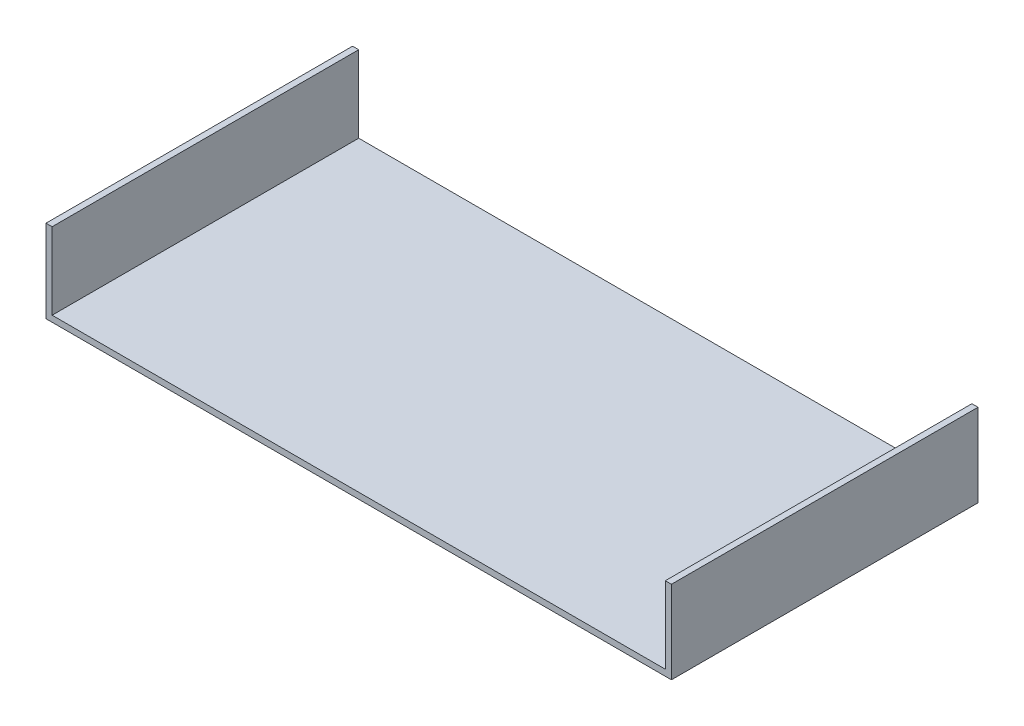
from build123d import *

# Parameters (mm, degrees)
BOSS_EXTRUDE1_DEPTH = 10000


with BuildPart() as part:
    # Sketch2 → Boss-Extrude1 (new body)
    with BuildSketch(Plane.XY):
        Polygon((0, 0), (0, -2500), (20000, -2500), (20000, 0), (20200, 0), (20200, -2700), (-200, -2700), (-200, 0), align=None)
    extrude(amount=-BOSS_EXTRUDE1_DEPTH)


solid = part.part
